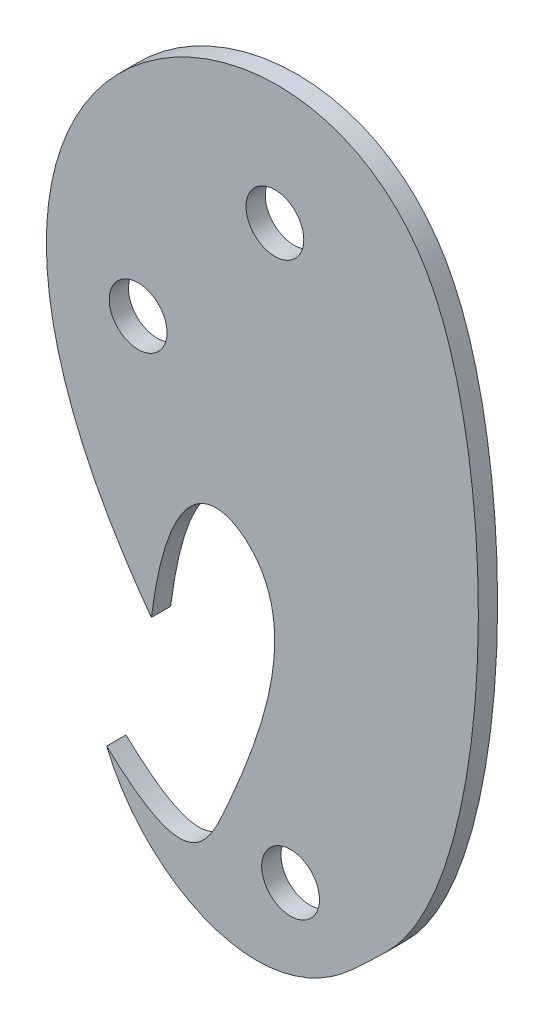
from build123d import *

# Parameters (mm, degrees)
SKETCH1_R           = 3
BOSS_EXTRUDE1_DEPTH = 2


with BuildPart() as part:
    # Sketch1 → Boss-Extrude1 (new body)
    with BuildSketch(Plane.XY):
        with BuildLine():
            ThreePointArc((32.19406205, -17.810203093), (34.004806039, -16.126941486), (35.787561743, -14.414065094))
            add(Edge.make_bspline(
                [(11.378973774, 3.463257982), (-20.428079659, 46.561414382), (31.035983519, 75.262771907), (47.834715517, 28.357171922), (45.468507141, -4.957929113), (35.787561743, -14.414065094)],
                knots=[0, 0, 0, 0, 0.599100037, 0.662517606, 0.977567835, 0.977567835, 0.977567835, 0.977567835], degree=3))
            add(Edge.make_bspline(
                [(11.378973774, 3.463257982), (13.365800423, 19.100858267), (28.926423979, 15.35029216), (21.063971919, -6.395817412), (15.153515843, -18.353465234), (6.741063931, -10.420697396)],
                knots=[0, 0, 0, 0, 0.26677765, 0.750922652, 1, 1, 1, 1], degree=3))
            add(Edge.make_bspline(
                [(6.741063931, -10.420697396), (10.445950674, -19.708893243), (22.444364812, -26.724844927), (32.19406205, -17.810203093)],
                knots=[0, 0, 0, 0, 0.946117245, 0.946117245, 0.946117245, 0.946117245], degree=3))
        make_face()
        with Locations((24.20370128, 45.338419783)):
            Circle(SKETCH1_R, mode=Mode.SUBTRACT)
        with Locations((10, 29.870554062)):
            Circle(SKETCH1_R, mode=Mode.SUBTRACT)
        with Locations((25.833353061, -13.177172292)):
            Circle(SKETCH1_R, mode=Mode.SUBTRACT)
    extrude(amount=BOSS_EXTRUDE1_DEPTH)


solid = part.part
